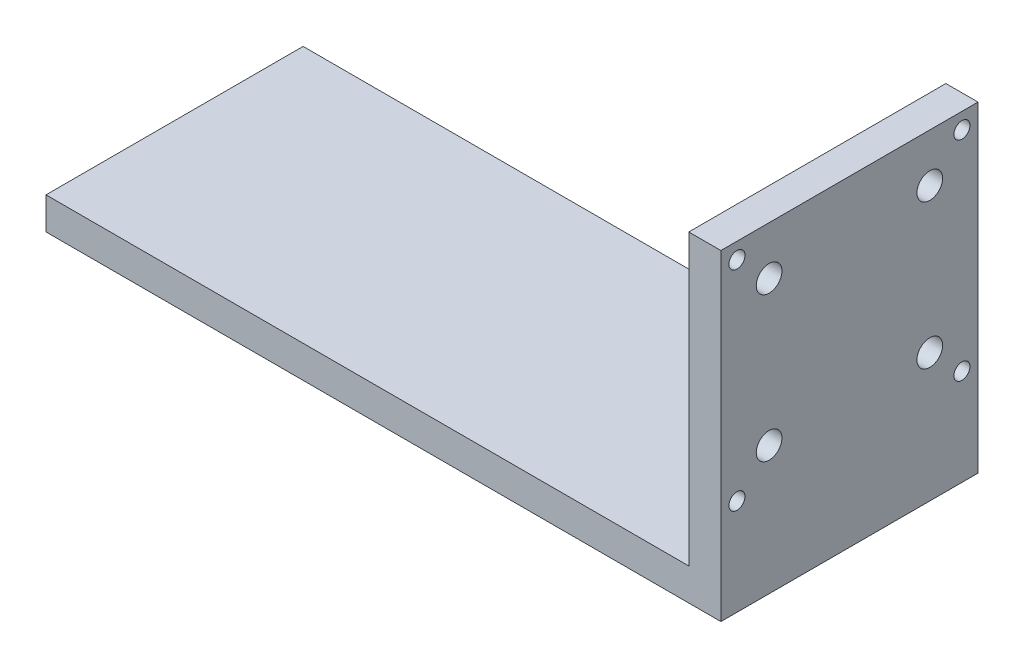
from build123d import *

# Parameters (mm, degrees)
SKETCH2_W           = 200
SKETCH2_H           = 80
BOSS_EXTRUDE1_DEPTH = 10
SKETCH3_W           = 80
SKETCH3_H           = 100
BOSS_EXTRUDE2_DEPTH = 10
SKETCH6_R           = 4
CUT_EXTRUDE2_DEPTH  = 10
SKETCH8_R           = 2.5
CUT_EXTRUDE3_DEPTH  = 100


with BuildPart() as part:
    # Sketch2 → Boss-Extrude1 (new body)
    with BuildSketch(Plane(origin=(0, 0, 0), x_dir=(1, 0, 0), z_dir=(0, 1, 0))):
        Rectangle(SKETCH2_W, SKETCH2_H)
    extrude(amount=BOSS_EXTRUDE1_DEPTH)

    # Sketch3 → Boss-Extrude2 (add)
    with BuildSketch(Plane(origin=(100, 0, 0), x_dir=(0, 0, -1), z_dir=(1, 0, 0))):
        with Locations((0, 50)):
            Rectangle(SKETCH3_W, SKETCH3_H)
    extrude(amount=BOSS_EXTRUDE2_DEPTH)

    # Sketch6 → Cut-Extrude2 (cut)
    with BuildSketch(Plane.ZY.offset(-100)):
        with Locations((-25, 85)):
            Circle(SKETCH6_R)
        with Locations((25, 85)):
            Circle(SKETCH6_R)
        with Locations((-25, 40)):
            Circle(SKETCH6_R)
        with Locations((25, 40)):
            Circle(SKETCH6_R)
    extrude(amount=-CUT_EXTRUDE2_DEPTH, mode=Mode.SUBTRACT)

    # Sketch8 → Cut-Extrude3 (cut)
    with BuildSketch(Plane.ZY.offset(-100)):
        with Locations((-35, 95)):
            Circle(SKETCH8_R)
        with Locations((35, 95)):
            Circle(SKETCH8_R)
        with Locations((-35, 30)):
            Circle(SKETCH8_R)
        with Locations((35, 30)):
            Circle(SKETCH8_R)
    extrude(amount=-CUT_EXTRUDE3_DEPTH, mode=Mode.SUBTRACT)


solid = part.part
